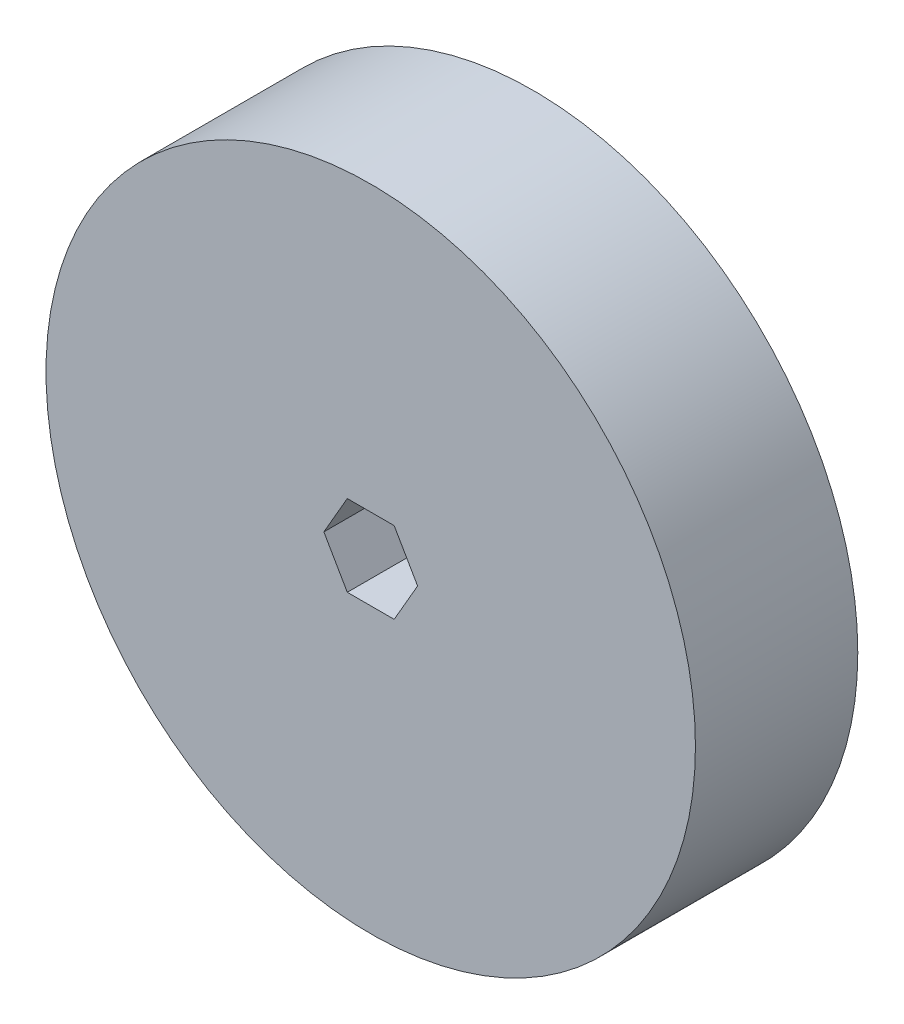
from build123d import *

# Parameters (mm, degrees)
SKETCH1_R           = 50.8
BOSS_EXTRUDE1_DEPTH = 25.4


with BuildPart() as part:
    # Sketch1 → Boss-Extrude1 (new body)
    with BuildSketch(Plane.XY):
        Circle(SKETCH1_R)
        Polygon((7.332348419, 0), (3.666174209, 6.35), (-3.666174209, 6.35), (-7.332348419, 0), (-3.666174209, -6.35), (3.666174209, -6.35), align=None, mode=Mode.SUBTRACT)
    extrude(amount=BOSS_EXTRUDE1_DEPTH)


solid = part.part
